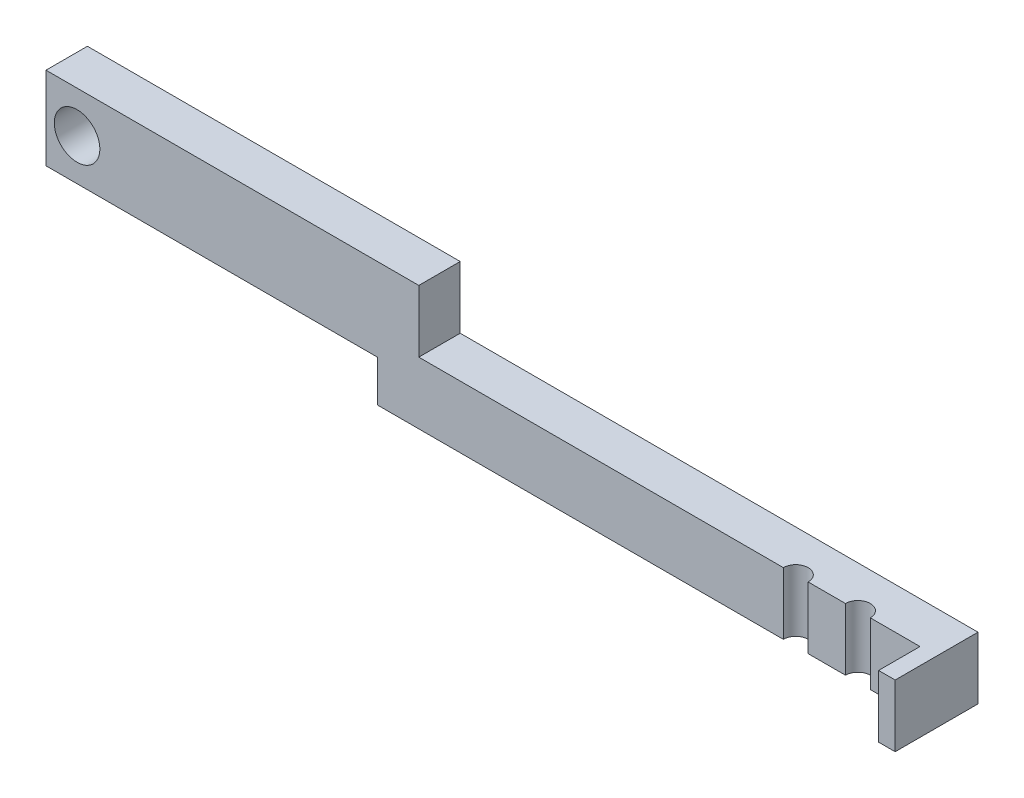
from build123d import *

# Parameters (mm, degrees)
SALIENTE_EXTRUIR1_DEPTH = 2
CROQUIS3_W              = 0.8
CROQUIS3_H              = 3
SALIENTE_EXTRUIR2_DEPTH = 2
CROQUIS4_R              = 0.6
CORTAR_EXTRUIR1_DEPTH   = 44.289721644
CROQUIS5_R              = 1.1
CORTAR_EXTRUIR2_DEPTH   = 44.370496884


with BuildPart() as part:
    # Croquis1 → Saliente-Extruir1 (new body)
    with BuildSketch(Plane.XY):
        Polygon((0, 0), (16, 0), (16, -2), (19, -2), (43, -2), (43, 1), (18, 1), (18, 4), (15, 4), (0, 4), align=None)
    extrude(amount=SALIENTE_EXTRUIR1_DEPTH)

    # Croquis3 → Saliente-Extruir2 (add)
    with BuildSketch(Plane.XY.offset(2)):
        with Locations((42.6, -0.5)):
            Rectangle(CROQUIS3_W, CROQUIS3_H)
    extrude(amount=SALIENTE_EXTRUIR2_DEPTH)

    # Croquis4 → Cortar-Extruir1 (cut, through all)
    with BuildSketch(Plane(origin=(0, 1, 0), x_dir=(1, 0, 0), z_dir=(0, 1, 0))):
        with Locations((39.2, -2)):
            Circle(CROQUIS4_R)
        with Locations((36.2, -2)):
            Circle(CROQUIS4_R)
    extrude(amount=-CORTAR_EXTRUIR1_DEPTH, mode=Mode.SUBTRACT)

    # Croquis5 → Cortar-Extruir2 (cut, through all)
    with BuildSketch(Plane(origin=(0, 0, 0), x_dir=(-1, 0, 0), z_dir=(0, 0, -1))):
        with Locations((-1.5, 2)):
            Circle(CROQUIS5_R)
    extrude(amount=-CORTAR_EXTRUIR2_DEPTH, mode=Mode.SUBTRACT)


solid = part.part
